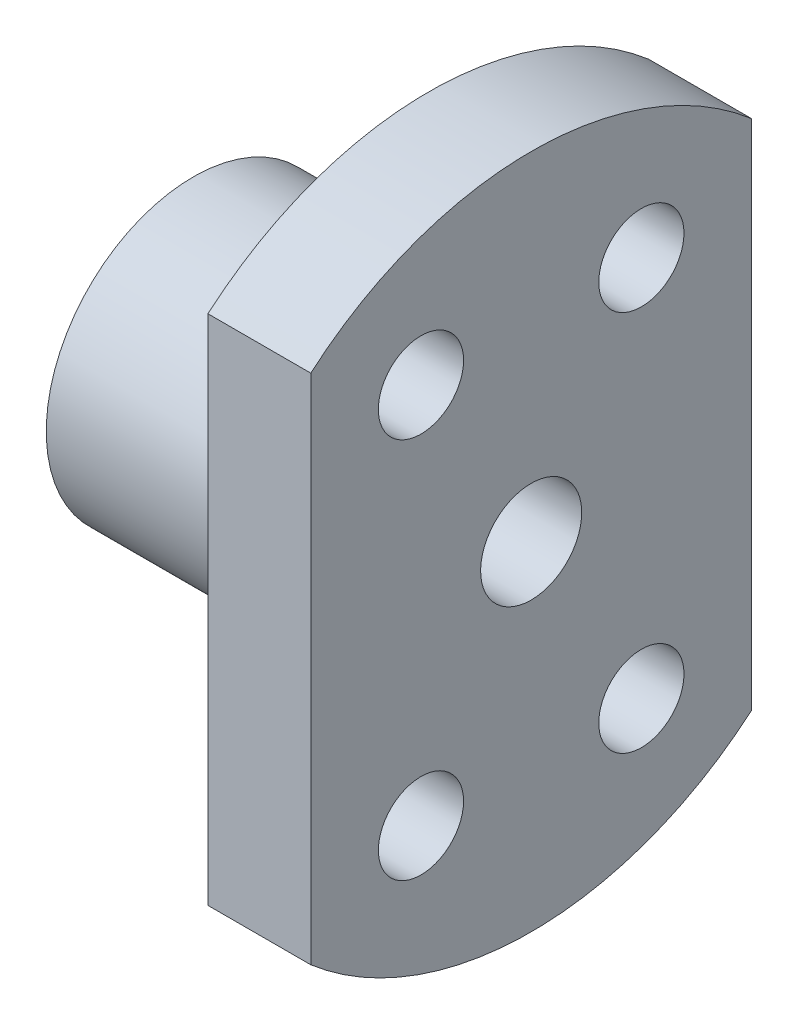
from build123d import *

# Parameters (mm, degrees)
SKETCH_3_R           = 1.72
CUT_EXTRUDE_1_DEPTH  = 20.918584287
SKETCH_5_R           = 1.45
CUT_EXTRUDE_2_DEPTH  = 20.918584287
SKETCH_6_OUTSIDE_W   = 31.9
SKETCH_6_OUTSIDE_H   = 31.9
SKETCH_6_OUTSIDE_W_2 = 15
SKETCH_6_OUTSIDE_H_2 = 23
CUT_EXTRUDE_3_DEPTH  = 20.918584287


with BuildPart() as part:
    # 草图2 → 旋转1 (revolve)
    with BuildSketch(Plane.XY, mode=Mode.PRIVATE) as revolve_1_sk:
        Polygon((-5.75, 0), (-5.75, 5), (2.25, 5), (2.25, 11.5), (5.75, 11.5), (5.75, 0), align=None)
    revolve(revolve_1_sk.sketch.rotate(Axis((5.75, 0, 0), (-1, 0, 0)), 90), axis=Axis((5.75, 0, 0), (-1, 0, 0)))

    # 草图3 → 切除-拉伸1 (cut, through all)
    with BuildSketch(Plane.ZY.offset(5.75)):
        with Locations(Location((0, 0, 0), (0, 0, 270))):
            Circle(SKETCH_3_R)
    extrude(amount=-CUT_EXTRUDE_1_DEPTH, mode=Mode.SUBTRACT)

    # 草图5 → 切除-拉伸2 (cut, through all)
    with BuildSketch(Plane(origin=(5.75, 0, 0), x_dir=(0, 0, -1), z_dir=(1, 0, 0))):
        with Locations((-3.75, 6.495190528)):
            Circle(SKETCH_5_R)
        with Locations((3.75, 6.495190528)):
            Circle(SKETCH_5_R)
        with Locations((-3.75, -6.495190528)):
            Circle(SKETCH_5_R)
        with Locations((3.75, -6.495190528)):
            Circle(SKETCH_5_R)
    extrude(amount=-CUT_EXTRUDE_2_DEPTH, mode=Mode.SUBTRACT)

    # 草图6 outside → 切除-拉伸3 (cut, through all)
    with BuildSketch(Plane(origin=(5.75, 0, 0), x_dir=(0, 0, -1), z_dir=(1, 0, 0))):
        Rectangle(SKETCH_6_OUTSIDE_W, SKETCH_6_OUTSIDE_H)
        Rectangle(SKETCH_6_OUTSIDE_W_2, SKETCH_6_OUTSIDE_H_2, mode=Mode.SUBTRACT)
    extrude(amount=-CUT_EXTRUDE_3_DEPTH, mode=Mode.SUBTRACT)


solid = part.part
